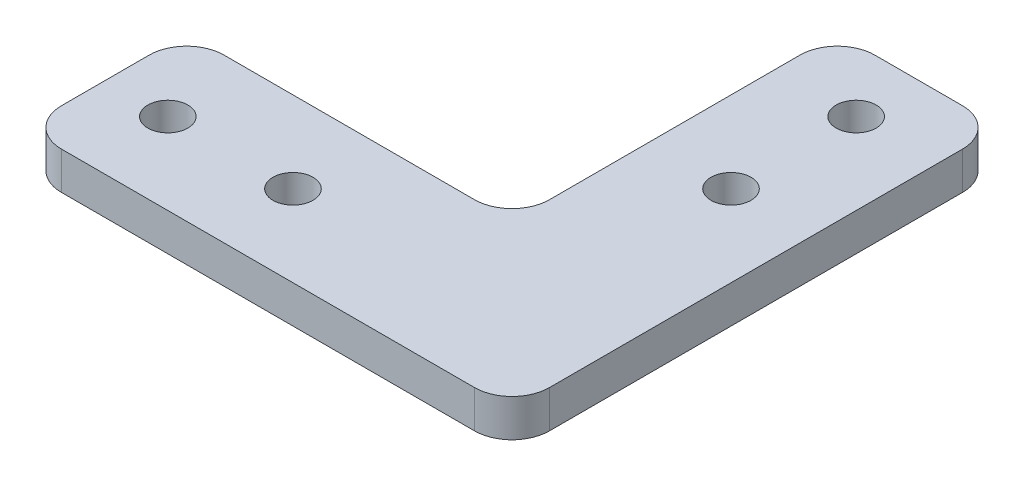
from build123d import *

# Parameters (mm, degrees)
SKETCH_1_R      = 1.6
EXTRUDE_1_DEPTH = 3
FILLET_1_R      = 3


with BuildPart() as part:
    # 草图1 → 凸台-拉伸1 (new body)
    with BuildSketch(Plane(origin=(0, 0, 0), x_dir=(1, 0, 0), z_dir=(0, 1, 0))):
        Polygon((-13, 0), (0, 0), (0, 13), (0, 39), (-13, 39), (-13, 13), (-39, 13), (-39, 0), align=None)
        with Locations(Location((-34, 6.5, 0), (0, 0, 270))):
            Circle(SKETCH_1_R, mode=Mode.SUBTRACT)
        with Locations(Location((-24, 6.5, 0), (0, 0, 270))):
            Circle(SKETCH_1_R, mode=Mode.SUBTRACT)
        with Locations(Location((-6.5, 24, 0), (0, 0, 270))):
            Circle(SKETCH_1_R, mode=Mode.SUBTRACT)
        with Locations(Location((-6.5, 34, 0), (0, 0, 270))):
            Circle(SKETCH_1_R, mode=Mode.SUBTRACT)
    extrude(amount=EXTRUDE_1_DEPTH)

    # 圆角1
    fillet_1_edges = [part.edges().sort_by_distance(p)[0] for p in [
        (-13, 1.5, -39),
        (0, 1.5, -39),
        (0, 1.5, 0),
        (-39, 1.5, 0),
        (-39, 1.5, -13),
        (-13, 1.5, -13),
    ]]
    fillet(fillet_1_edges, radius=FILLET_1_R)


solid = part.part
